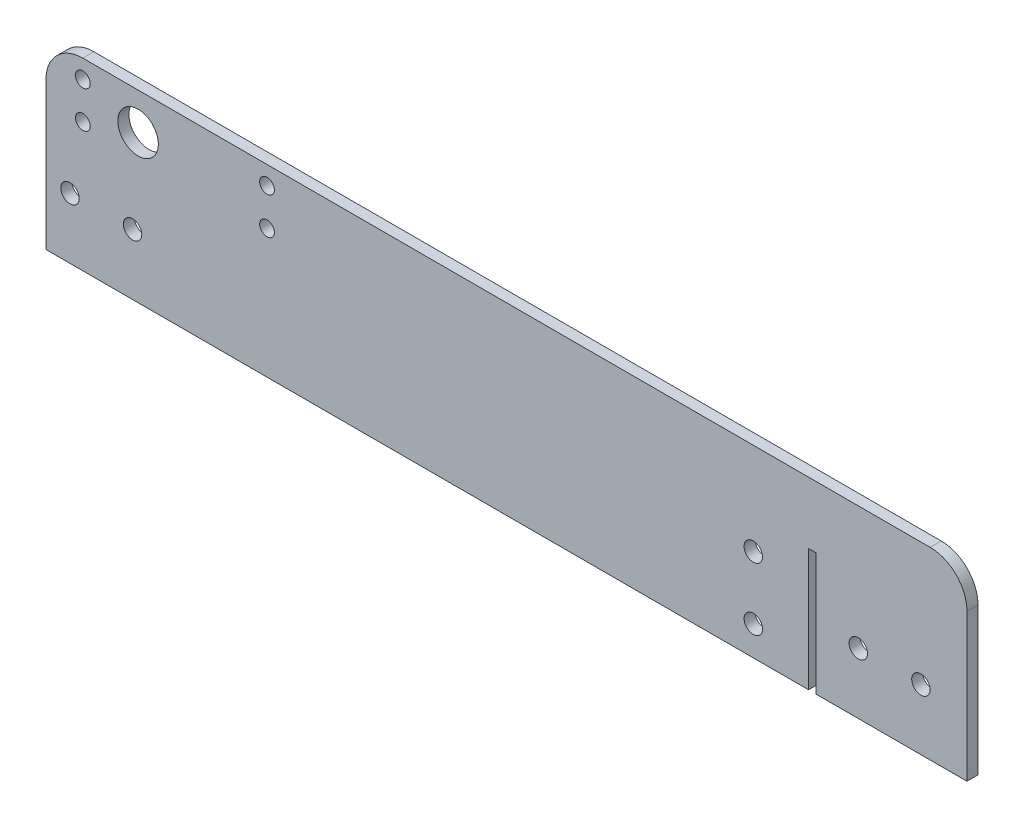
from build123d import *

# Parameters (mm, degrees)
SKETCH_2_R          = 2
SKETCH_2_R_2        = 5.5
SKETCH_2_R_3        = 2.5
EXTRUDE_1_DEPTH     = 1.5
SKETCH_3_R          = 2.5
CUT_EXTRUDE_1_DEPTH = 10


with BuildPart() as part:
    # 草图2 → 凸台-拉伸1 (new, symmetric)
    with BuildSketch(Plane.XY):
        with BuildLine():
            Line((120, 0), (207, 0))
            Line((207, 0), (207, 33.215924565))
            Line((207, 33.215924565), (208.99932908, 33.215924565))
            Line((208.99932908, 33.215924565), (208.99932908, 0))
            Line((208.99932908, 0), (250, 0))
            Line((250, 0), (250, 40))
            ThreePointArc((250, 40), (247.071067812, 47.071067812), (240, 50))
            Line((240, 50), (10, 50))
            ThreePointArc((10, 50), (2.928932188, 47.071067812), (0, 40))
            Line((0, 40), (0, 0))
            Line((0, 0), (30, 0))
            Line((30, 0), (120, 0))
        make_face()
        with Locations((10, 45)):
            Circle(SKETCH_2_R, mode=Mode.SUBTRACT)
        with Locations((10, 35)):
            Circle(SKETCH_2_R, mode=Mode.SUBTRACT)
        with Locations((60, 45)):
            Circle(SKETCH_2_R, mode=Mode.SUBTRACT)
        with Locations((60, 35)):
            Circle(SKETCH_2_R, mode=Mode.SUBTRACT)
        with Locations((25, 40)):
            Circle(SKETCH_2_R_2, mode=Mode.SUBTRACT)
        with Locations((6.5, 16.5)):
            Circle(SKETCH_2_R_3, mode=Mode.SUBTRACT)
        with Locations((23.5, 16.5)):
            Circle(SKETCH_2_R_3, mode=Mode.SUBTRACT)
        with Locations((220.5, 16.5)):
            Circle(SKETCH_2_R_3, mode=Mode.SUBTRACT)
        with Locations((237.5, 16.5)):
            Circle(SKETCH_2_R_3, mode=Mode.SUBTRACT)
    extrude(amount=EXTRUDE_1_DEPTH, both=True)

    # 草图3 → 切除-拉伸1 (cut)
    with BuildSketch(Plane.XY.offset(1.5)):
        with Locations((192, 25)):
            Circle(SKETCH_3_R)
        with Locations((192, 8)):
            Circle(SKETCH_3_R)
    extrude(amount=-CUT_EXTRUDE_1_DEPTH, mode=Mode.SUBTRACT)


solid = part.part
